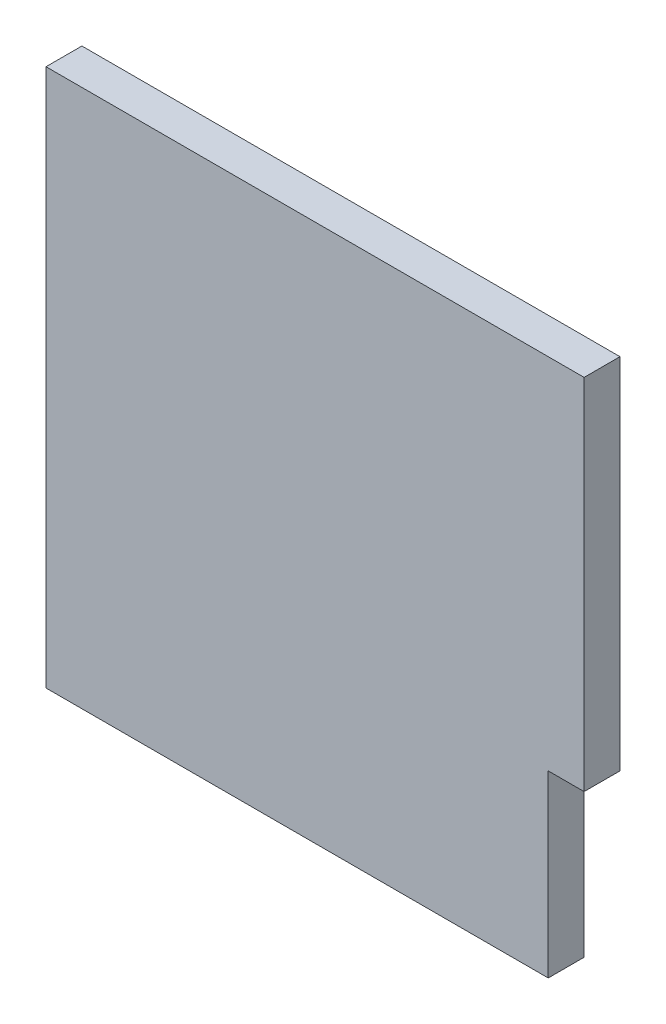
from build123d import *

# Parameters (mm, degrees)
BOSS_EXTRUDE1_DEPTH = 0.05


with BuildPart() as part:
    # Sketch1 → Boss-Extrude1 (new, symmetric)
    with BuildSketch(Plane.XY):
        Polygon((0, 0), (0, 1), (-1.5, 1), (-1.5, -0.5), (-0.1, -0.5), (-0.1, 0), align=None)
    extrude(amount=BOSS_EXTRUDE1_DEPTH, both=True)


solid = part.part
